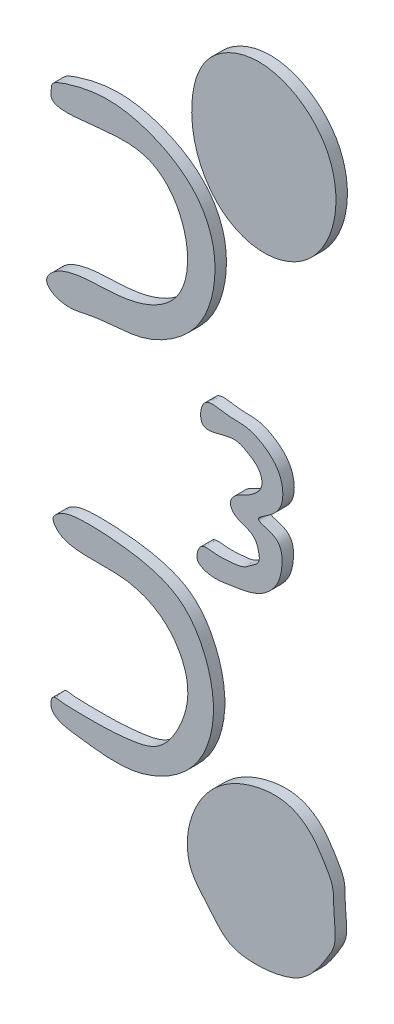
from build123d import *

# Parameters (mm, degrees)
BOSS_EXTRU_1_DEPTH   = 1
BOSS_EXTRU_1_2_DEPTH = 1
BOSS_EXTRU_1_3_DEPTH = 1
BOSS_EXTRU_1_4_DEPTH = 1
BOSS_EXTRU_1_5_DEPTH = 1


with BuildPart() as part:
    # Esquisse2 → Boss.-Extru.1 (new body)
    with BuildSketch(Plane.XY):
        with BuildLine():
            add(Edge.make_bspline(
                [(31.486199082, 35.282484495), (30.910615979, 36.499292935), (31.148708774, 39.788355998), (33.649008914, 43.230440758), (37.075824576, 44.679962616), (40.009261765, 44.804763891), (41.992377199, 43.454181562), (42.993293598, 41.875170474), (43.997974424, 40.263675442), (43.802020644, 38.164778085), (44.243419518, 36.190360007), (43.250448547, 34.52579714), (42.358128836, 33.158938669), (41.030733339, 31.862385218), (39.065843692, 31.185763655), (37.014164227, 30.962294001), (34.507006088, 31.313714857), (33.03982459, 33.3107644), (31.827910257, 34.560091775), (31.486199082, 35.282484495)],
                knots=[0, 0, 0, 0, 0.100098528, 0.211397945, 0.293708053, 0.362647884, 0.413623386, 0.45826231, 0.498624576, 0.546325436, 0.607040937, 0.636395312, 0.682371471, 0.726525175, 0.767053884, 0.829754858, 0.876744786, 0.94057368, 1, 1, 1, 1], degree=3))
        make_face()
    extrude(amount=BOSS_EXTRU_1_DEPTH)


with BuildPart() as body_2:
    # Esquisse2 → Boss.-Extru.1 2 (new body)
    with BuildSketch(Plane.XY):
        with BuildLine():
            add(Edge.make_bspline(
                [(31.486199082, 92.697060672), (31.503168068, 91.610437971), (31.907293465, 89.356655013), (33.880541203, 86.362529222), (37.383574714, 84.870172918), (41.583122714, 85.932500345), (44.530449546, 90.387957633), (43.909638671, 96.886094763), (37.95712833, 100.508618987), (32.244069675, 97.961551828), (31.459288893, 94.42027624), (31.486199082, 92.697060672)],
                knots=[0, 0, 0, 0, 0.076954783, 0.165433038, 0.247246601, 0.336953253, 0.456004801, 0.603420704, 0.762458455, 0.877961614, 1, 1, 1, 1], degree=3))
        make_face()
    extrude(amount=BOSS_EXTRU_1_2_DEPTH)


with BuildPart() as body_3:
    # Esquisse2 → Boss.-Extru.1 3 (new body)
    with BuildSketch(Plane.XY):
        with BuildLine():
            add(Edge.make_bspline(
                [(32.077390392, 58.955793155), (31.916536022, 59.146167784), (31.931095887, 59.709712637), (32.350994977, 60.568038136), (33.618451958, 60.294115646), (34.791490446, 60.388084357), (36.018215047, 60.484191401), (36.718434478, 61.0966383), (37.483275403, 61.55863198), (37.338412496, 62.48732991), (37.014625176, 63.418303554), (35.997615523, 63.78761972), (35.112665613, 64.114154613), (34.73800492, 64.954340297), (35.283937219, 65.747562414), (36.15304808, 66.075181126), (37.024113345, 66.60820189), (37.809153993, 67.48435839), (37.407433188, 68.808032182), (36.392050205, 69.421500133), (34.852725726, 70.258176914), (31.986019963, 68.461711269), (32.357878899, 71.965935327), (34.588312962, 71.247851339), (36.270259729, 71.443820147), (37.941428445, 70.647382195), (39.361761765, 69.326087298), (39.61373257, 67.046839337), (38.630270722, 65.778506437), (36.653118746, 64.699459584), (39.377534264, 64.420882314), (39.458012258, 62.403693643), (39.04488279, 60.618240222), (37.498642225, 59.030368652), (35.052463942, 58.673332211), (33.043175817, 58.308080601), (32.142266562, 58.879010804), (32.077390392, 58.955793155)],
                knots=[0, 0, 0, 0, 0.015980954, 0.029747166, 0.053635009, 0.082119409, 0.10779756, 0.124872517, 0.139963427, 0.157849568, 0.175956925, 0.198942844, 0.220104023, 0.232580286, 0.24966107, 0.271846097, 0.289785078, 0.313456217, 0.337569772, 0.363431066, 0.385064081, 0.446144832, 0.480391114, 0.519874987, 0.557582283, 0.589620029, 0.629519882, 0.674289648, 0.712534776, 0.736788102, 0.767963246, 0.811467706, 0.841390873, 0.88323593, 0.937097798, 0.993554523, 1, 1, 1, 1], degree=3))
        make_face()
    extrude(amount=BOSS_EXTRU_1_3_DEPTH)


with BuildPart() as body_4:
    # Esquisse2 → Boss.-Extru.1 4 (new body)
    with BuildSketch(Plane.XY):
        with BuildLine():
            add(Edge.make_bspline(
                [(19.176909518, 41.813052401), (19.167728855, 42.058106107), (19.285630575, 42.570457452), (20.256089471, 42.366215505), (21.621392669, 42.366075998), (23.65763575, 42.323453296), (25.989529836, 42.495209808), (28.673296275, 42.923160039), (30.595185053, 45.64259088), (31.66719513, 49.40377736), (29.562652467, 53.213865269), (25.526239592, 54.858842014), (22.282256255, 54.336721718), (19.942198115, 54.891262203), (19.116039372, 55.999827055), (20.233400653, 56.886991297), (22.084307513, 57.14212004), (24.743446781, 56.997590359), (27.776835319, 56.598727127), (30.897577173, 55.387319586), (33.057320676, 51.951262896), (33.767452194, 47.467134922), (31.820127419, 42.641700227), (26.796087001, 39.891229634), (22.939166882, 40.3253883), (19.21272931, 40.856937008), (19.176909518, 41.813052401)],
                knots=[0, 0, 0, 0, 0.009717682, 0.016793034, 0.036826419, 0.072203179, 0.102120304, 0.139041742, 0.182965177, 0.235951568, 0.301061115, 0.34775718, 0.415504337, 0.438297593, 0.450011566, 0.464165613, 0.486697889, 0.533472924, 0.576157347, 0.619387001, 0.671801883, 0.742038271, 0.808120921, 0.883635394, 0.962084941, 1, 1, 1, 1], degree=3))
        make_face()
    extrude(amount=BOSS_EXTRU_1_4_DEPTH)


with BuildPart() as body_5:
    # Esquisse2 → Boss.-Extru.1 5 (new body)
    with BuildSketch(Plane.XY):
        with BuildLine():
            add(Edge.make_bspline(
                [(19.369983976, 74.584333318), (19.545538894, 74.728243035), (20.198464126, 75.170983877), (22.075245468, 75.567709696), (24.474992879, 75.564436877), (27.410541456, 75.927461992), (30.525532258, 77.81786434), (31.591714484, 81.97965199), (29.926781389, 86.305000282), (25.853865259, 88.409096082), (19.037769788, 86.519071164), (19.220400801, 88.630447194), (19.306269425, 89.007619954), (22.094324946, 89.990259748), (25.238794367, 90.234904328), (29.182306503, 88.961601311), (32.092356176, 86.87097638), (33.469468628, 83.889271655), (33.645752013, 80.23472237), (32.175887213, 76.116184964), (26.890213091, 72.874398504), (24.478787125, 73.396929799), (20.096707493, 72.356545751), (17.957516091, 73.426474251), (19.369983976, 74.584333318)],
                knots=[0, 0, 0, 0, 0.006358774, 0.018777625, 0.033085894, 0.053103809, 0.074272174, 0.097689844, 0.129043083, 0.152295551, 0.189987057, 0.195853321, 0.210958184, 0.249640096, 0.341579473, 0.412116689, 0.491571817, 0.550022094, 0.602635191, 0.709018345, 0.799128832, 0.928751886, 0.948839003, 1, 1, 1, 1], degree=3))
        make_face()
    extrude(amount=BOSS_EXTRU_1_5_DEPTH)


solid = Compound([part.part, body_2.part, body_3.part, body_4.part, body_5.part])
